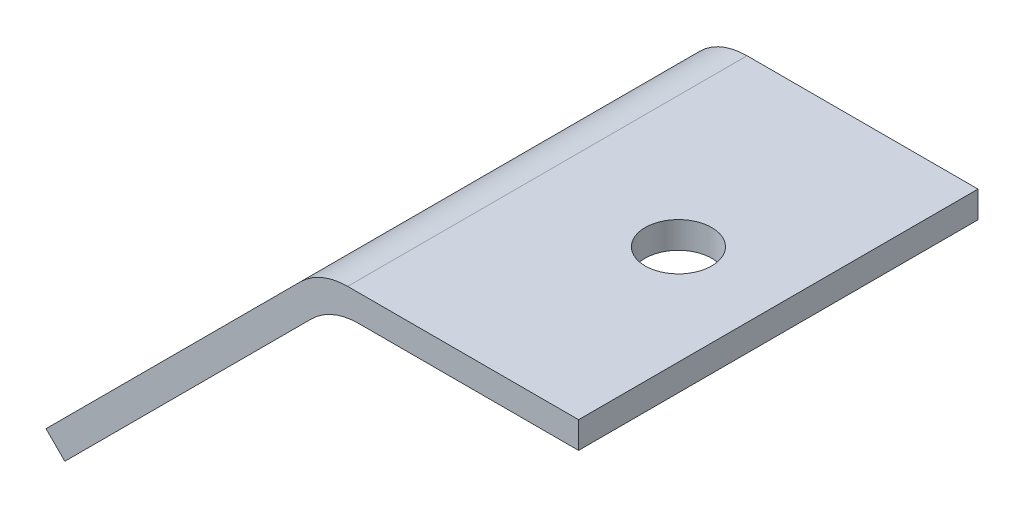
from build123d import *

# Parameters (mm, degrees)
BOSS_EXTRUDE1_DEPTH = 60
FILLET1_R           = 10
SKETCH2_R           = 5
CUT_EXTRUDE1_DEPTH  = 60


with BuildPart() as part:
    # Sketch1 → Boss-Extrude1 (new body)
    with BuildSketch(Plane.XY):
        Polygon((-86.358974359, -10), (-83.530547234, -12.828427125), (-43.530547234, 27.171572875), (-6.358974359, 27.171572875), (-6.358974359, 31.171572875), (-45.187401484, 31.171572875), align=None)
    extrude(amount=BOSS_EXTRUDE1_DEPTH)

    # Fillet1
    fillet1_edges = [part.edges().sort_by_distance(p)[0] for p in [
        (-45.187401484, 31.171572875, 30),
        (-43.530547234, 27.171572875, 30),
    ]]
    fillet(fillet1_edges, radius=FILLET1_R)

    # Sketch2 → Cut-Extrude1 (cut)
    with BuildSketch(Plane(origin=(0, 31.171572875, 0), x_dir=(1, 0, 0), z_dir=(0, 1, 0))):
        with Locations(Location((-21.358974359, -30, 0), (0, 0, 180))):
            Circle(SKETCH2_R)
    extrude(amount=-CUT_EXTRUDE1_DEPTH, mode=Mode.SUBTRACT)


solid = part.part
